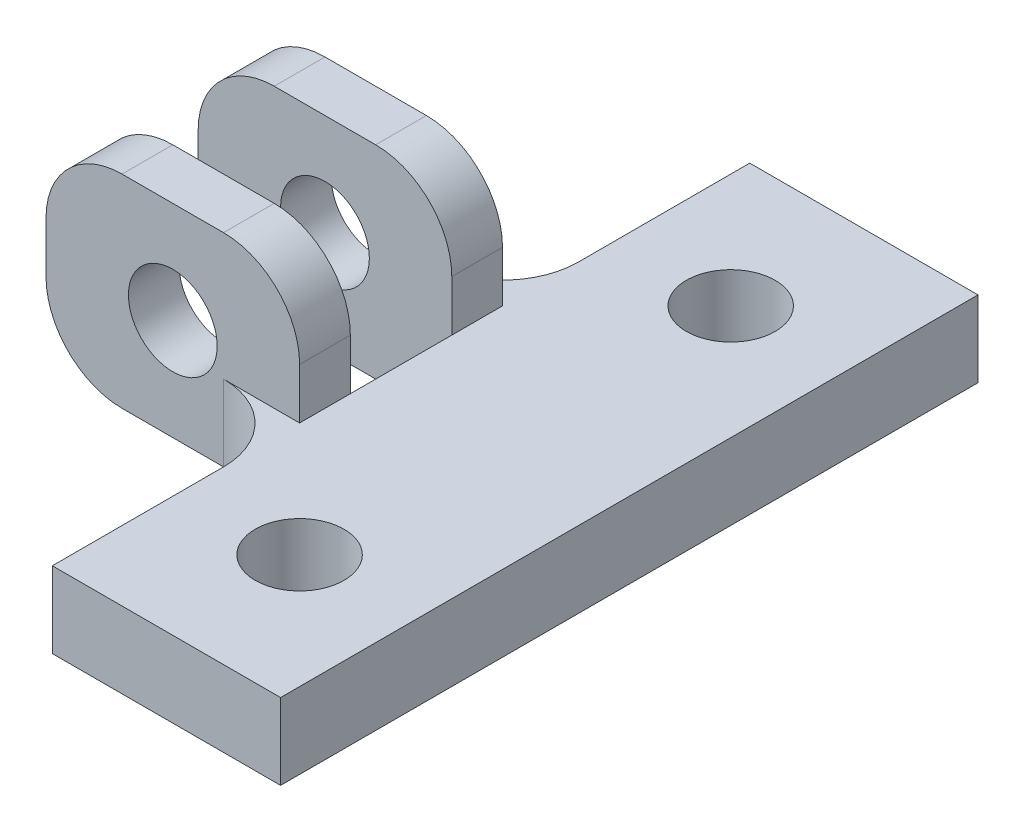
from build123d import *

# Parameters (mm, degrees)
SKETCH_1_W               = 9
SKETCH_1_H               = 27.5
SKETCH_1_R               = 1.75
EXTRUDE_1_DEPTH          = 3
SKETCH_2_W               = 2
SKETCH_2_H               = 3
EXTRUDE_2_DEPTH          = 10
SKETCH_3_W               = 10
SKETCH_3_H               = 2
EXTRUDE_3_DEPTH          = 8
CUT_EXTRUDE_1_DEPTH      = 40.17987366
CUT_EXTRUDE_1_DEPTH_BACK = 40.17987366
SKETCH_4_R               = 1.75
FILLET_2_R               = 3


with BuildPart() as part:
    # 草图1 → 凸台-拉伸1 (new body)
    with BuildSketch(Plane(origin=(0, 0, 0), x_dir=(1, 0, 0), z_dir=(0, 1, 0))):
        with Locations((-19.5, 0)):
            Rectangle(SKETCH_1_W, SKETCH_1_H)
        with Locations(Location((-19.5, 8.5, 0), (0, 0, 270))):
            Circle(SKETCH_1_R, mode=Mode.SUBTRACT)
        with Locations(Location((-19.5, -8.5, 0), (0, 0, 270))):
            Circle(SKETCH_1_R, mode=Mode.SUBTRACT)
    extrude(amount=EXTRUDE_1_DEPTH)

    # 草图2 → 凸台-拉伸2 (add)
    with BuildSketch(Plane.ZY.offset(24)):
        with Locations((-3, 1.5)):
            Rectangle(SKETCH_2_W, SKETCH_2_H)
        with Locations((3, 1.5)):
            Rectangle(SKETCH_2_W, SKETCH_2_H)
    extrude(amount=EXTRUDE_2_DEPTH)

    # 草图3 → 凸台-拉伸3 (add)
    with BuildSketch(Plane.XZ):
        with Locations((-29, 3)):
            Rectangle(SKETCH_3_W, SKETCH_3_H)
        with Locations((-29, -3)):
            Rectangle(SKETCH_3_W, SKETCH_3_H)
    extrude(amount=-EXTRUDE_3_DEPTH)

    # 草图4 → 切除-拉伸1 (cut, two sides: drawn at the far end of the back side and taken through both)
    with BuildSketch(Plane(origin=(0, 0, -4), x_dir=(-1, 0, 0), z_dir=(0, 0, -1)).offset(-CUT_EXTRUDE_1_DEPTH_BACK)):
        with Locations(Location((29, 4, 0), (0, 0, 180))):
            Circle(SKETCH_4_R)
    extrude(amount=CUT_EXTRUDE_1_DEPTH + CUT_EXTRUDE_1_DEPTH_BACK, mode=Mode.SUBTRACT)

    # 圆角2
    fillet_2_edges = [part.edges().sort_by_distance(p)[0] for p in [
        (-24, 1.5, -4),
        (-34, 0, 3),
        (-34, 0, -3),
        (-24, 1.5, 4),
        (-34, 8, 3),
        (-34, 8, -3),
        (-24, 8, -3),
        (-24, 8, 3),
    ]]
    fillet(fillet_2_edges, radius=FILLET_2_R)


solid = part.part
